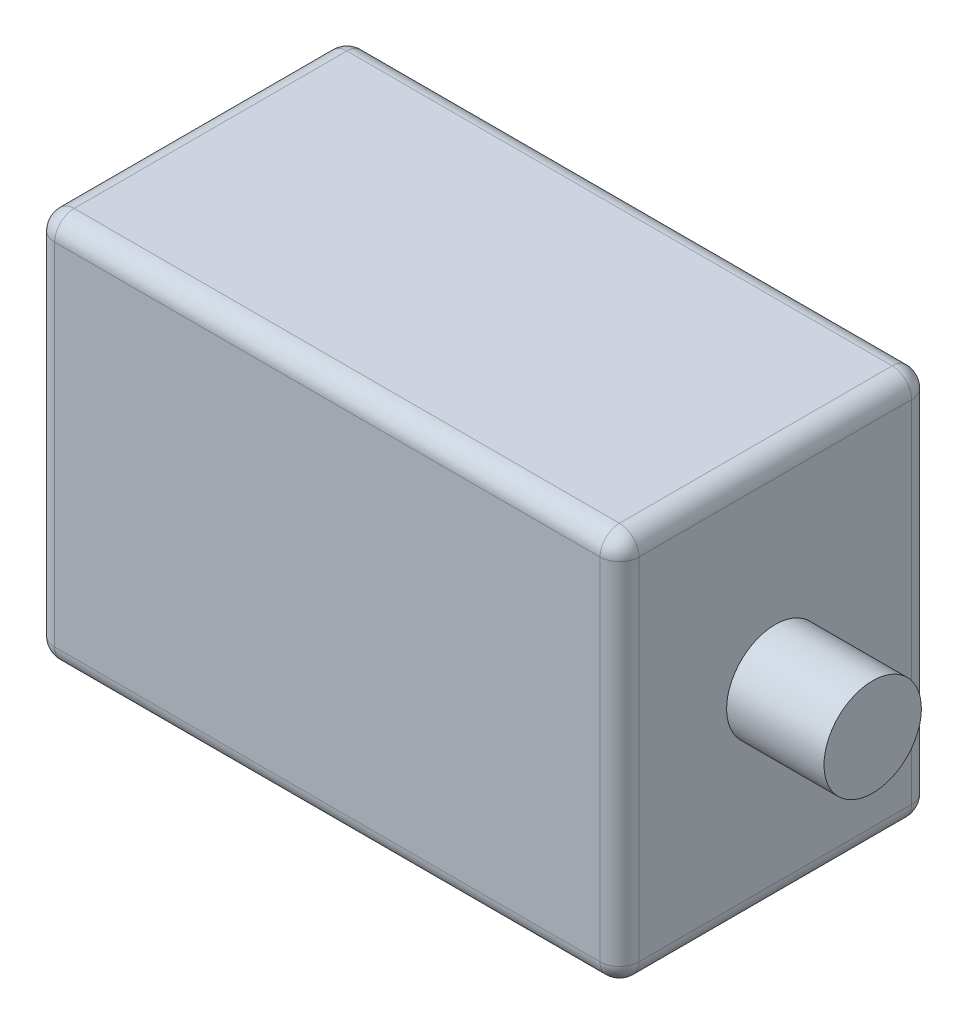
from build123d import *

# Parameters (mm, degrees)
SKETCH_1_W      = 30
SKETCH_1_H      = 20
EXTRUDE_1_DEPTH = 16
SKETCH_2_R      = 2.5
EXTRUDE_2_DEPTH = 5
FILLET_1_R      = 1


with BuildPart() as part:
    # 草图1 → 凸台-拉伸1 (new body)
    with BuildSketch(Plane.XY):
        Rectangle(SKETCH_1_W, SKETCH_1_H)
    extrude(amount=EXTRUDE_1_DEPTH)

    # 草图2 → 凸台-拉伸2 (add)
    with BuildSketch(Plane(origin=(15, 0, 0), x_dir=(0, 0, -1), z_dir=(1, 0, 0))):
        with Locations(Location((-8, 0, 0), (0, 0, 90))):
            Circle(SKETCH_2_R)
    extrude(amount=EXTRUDE_2_DEPTH)

    # 圆角1
    fillet_1_edges = [part.edges().sort_by_distance(p)[0] for p in [
        (-15, 0, 16),
        (0, -10, 16),
        (15, 0, 16),
        (0, -10, 0),
        (-15, 0, 0),
        (0, 10, 0),
        (15, 0, 0),
        (0, 10, 16),
        (15, -10, 8),
        (-15, -10, 8),
        (-15, 10, 8),
        (15, 10, 8),
    ]]
    fillet(fillet_1_edges, radius=FILLET_1_R)


solid = part.part
